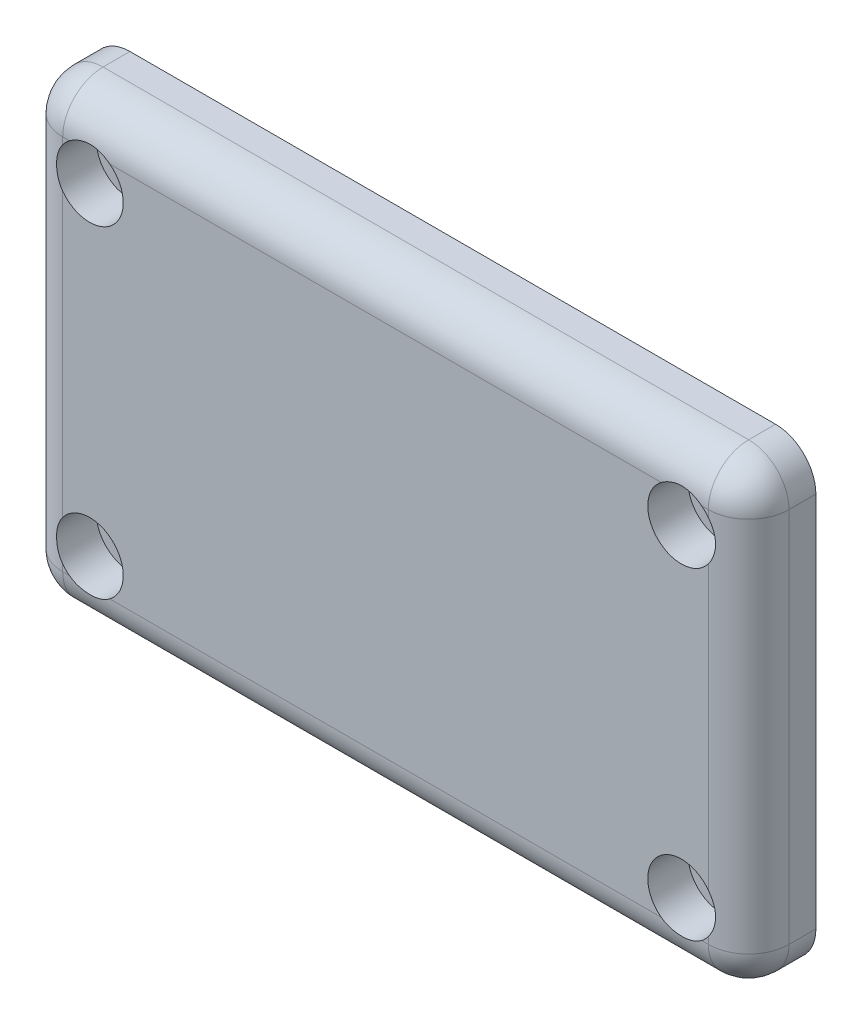
from build123d import *

# Parameters (mm, degrees)
SKETCH1_W           = 54
SKETCH1_H           = 34
SKETCH1_R           = 1
BOSS_EXTRUDE1_DEPTH = 5
FILLET2_R           = 3
SKETCH2_R           = 2.5
CUT_EXTRUDE1_DEPTH  = 3


with BuildPart() as part:
    # Sketch1 → Boss-Extrude1 (new body)
    with BuildSketch(Plane.XY):
        with Locations((27, -17)):
            Rectangle(SKETCH1_W, SKETCH1_H)
        with Locations((5, -5)):
            Circle(SKETCH1_R, mode=Mode.SUBTRACT)
        with Locations((49, -5)):
            Circle(SKETCH1_R, mode=Mode.SUBTRACT)
        with Locations((49, -29)):
            Circle(SKETCH1_R, mode=Mode.SUBTRACT)
        with Locations((5, -29)):
            Circle(SKETCH1_R, mode=Mode.SUBTRACT)
    extrude(amount=BOSS_EXTRUDE1_DEPTH)

    # Fillet2
    fillet2_edges = [part.edges().sort_by_distance(p)[0] for p in [
        (54, -17, 5),
        (27, 0, 5),
        (0, -17, 5),
        (0, 0, 2.5),
        (54, 0, 2.5),
        (54, -34, 2.5),
        (0, -34, 2.5),
        (27, -34, 5),
    ]]
    fillet(fillet2_edges, radius=FILLET2_R)

    # Sketch2 → Cut-Extrude1 (cut)
    with BuildSketch(Plane.XY.offset(5)):
        with Locations((5, -5)):
            Circle(SKETCH2_R)
        with Locations((5, -29)):
            Circle(SKETCH2_R)
        with Locations((49, -29)):
            Circle(SKETCH2_R)
        with Locations((49, -5)):
            Circle(SKETCH2_R)
    extrude(amount=-CUT_EXTRUDE1_DEPTH, mode=Mode.SUBTRACT)


solid = part.part
